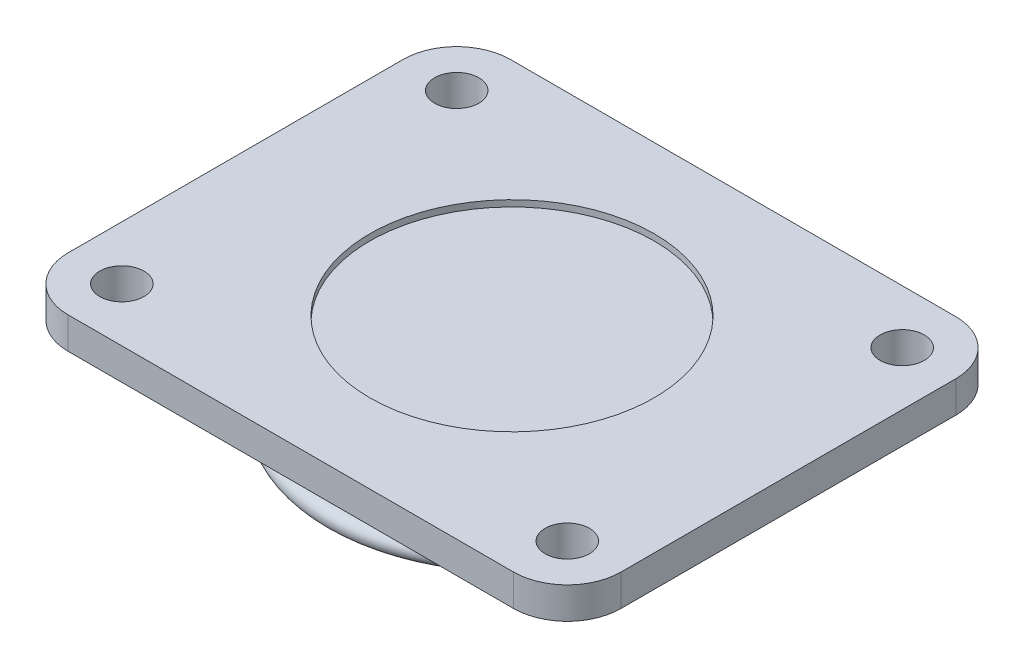
from build123d import *

# Parameters (mm, degrees)
SKETCH1_R           = 7
BOSS_EXTRUDE1_DEPTH = 10
SKETCH3_R           = 56
BOSS_EXTRUDE2_DEPTH = 20
SKETCH4_R           = 3
SKETCH5_R           = 7.5
BOSS_EXTRUDE3_DEPTH = 25
CHAMFER1_SIZE       = 1
SKETCH6_R           = 45
CUT_EXTRUDE1_DEPTH  = 2


with BuildPart() as part:
    # Sketch1 → Boss-Extrude1 (new body)
    with BuildSketch(Plane(origin=(0, 0, 0), x_dir=(1, 0, 0), z_dir=(0, 1, 0))):
        with BuildLine():
            Line((70.5, -70), (-70.5, -70))
            ThreePointArc((-70.5, -70), (-82.52081528, -65.02081528), (-87.5, -53))
            Line((-87.5, -53), (-87.5, 53))
            ThreePointArc((-87.5, 53), (-82.52081528, 65.02081528), (-70.5, 70))
            Line((-70.5, 70), (70.5, 70))
            ThreePointArc((70.5, 70), (82.52081528, 65.02081528), (87.5, 53))
            Line((87.5, 53), (87.5, -53))
            ThreePointArc((87.5, -53), (82.52081528, -65.02081528), (70.5, -70))
        make_face()
        with Locations(Location((-70.5, 53, 0), (0, 0, 270))):
            Circle(SKETCH1_R, mode=Mode.SUBTRACT)
        with Locations(Location((70.5, 53, 0), (0, 0, 270))):
            Circle(SKETCH1_R, mode=Mode.SUBTRACT)
        with Locations(Location((70.5, -53, 0), (0, 0, 270))):
            Circle(SKETCH1_R, mode=Mode.SUBTRACT)
        with Locations(Location((-70.5, -53, 0), (0, 0, 270))):
            Circle(SKETCH1_R, mode=Mode.SUBTRACT)
    extrude(amount=BOSS_EXTRUDE1_DEPTH)

    # Sketch3 → Boss-Extrude2 (add)
    with BuildSketch(Plane.XZ):
        with Locations(Location((0, 0, 0), (0, 0, 270))):
            Circle(SKETCH3_R)
    extrude(amount=BOSS_EXTRUDE2_DEPTH)

    # Sketch4 → Revolve1 (revolve)
    with BuildSketch(Plane(origin=(0, 0, 0), x_dir=(0, 0, -1), z_dir=(1, 0, 0)), mode=Mode.PRIVATE) as revolve1_sk:
        with Locations((-56, -17)):
            Circle(SKETCH4_R)
    revolve(revolve1_sk.sketch.rotate(Axis((0, 0, 0), (0, -1, 0)), 180), axis=Axis((0, 0, 0), (0, -1, 0)))

    # Sketch5 → Boss-Extrude3 (add)
    with BuildSketch(Plane.XZ.offset(20)):
        with Locations(Location((0, 0, 0), (0, 0, 270))):
            Circle(SKETCH5_R)
    extrude(amount=BOSS_EXTRUDE3_DEPTH)

    # Chamfer1
    chamfer1_edges = [part.edges().sort_by_distance(p)[0] for p in [
        (0, -45, 7.5),
    ]]
    chamfer(chamfer1_edges, length=CHAMFER1_SIZE)

    # Sketch6 → Cut-Extrude1 (cut)
    with BuildSketch(Plane(origin=(0, 10, 0), x_dir=(1, 0, 0), z_dir=(0, 1, 0))):
        with Locations(Location((0, 0, 0), (0, 0, 270))):
            Circle(SKETCH6_R)
    extrude(amount=-CUT_EXTRUDE1_DEPTH, mode=Mode.SUBTRACT)


solid = part.part
